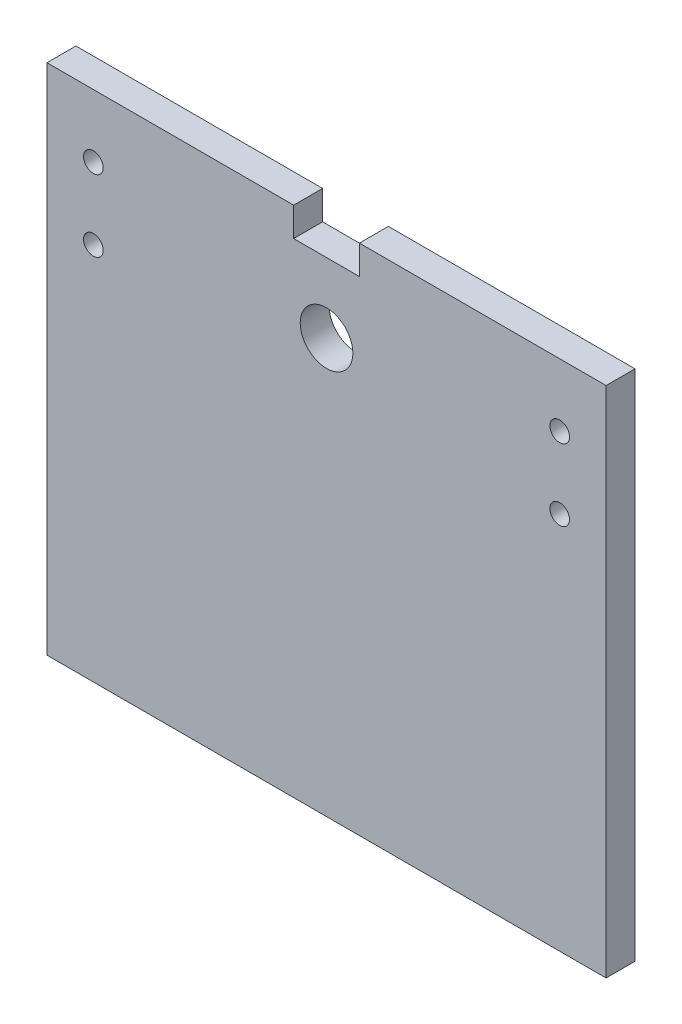
from build123d import *

# Parameters (mm, degrees)
BOSS_EXTRUDE1_DEPTH   = 2.794
F_6_CLEARANCE_HOLE1_D = 3.7973
CUT_EXTRUDE1_REACH    = 75.469
SKETCH5_R             = 5.08


with BuildPart() as part:
    # Sketch1 → Boss-Extrude1 (new, symmetric)
    with BuildSketch(Plane.XY):
        Polygon((-6.35, 49.53), (-6.35, 43.942), (6.35, 43.942), (6.35, 49.53), (53.975, 49.53), (53.975, -49.53), (-53.975, -49.53), (-53.975, 49.53), align=None)
    extrude(amount=BOSS_EXTRUDE1_DEPTH, both=True)

    # #6 Clearance Hole1 (through all)
    with Locations(Plane(origin=(0, 0, -2.794), x_dir=(-1, 0, 0), z_dir=(0, 0, -1))):
        with Locations((-45.014797213, 37.394797213), (-45.014797213, 23.565202787), (45.014797213, 37.394797213), (45.014797213, 23.565202787)):
            Hole(F_6_CLEARANCE_HOLE1_D / 2)

    # Sketch5 → Cut-Extrude1 (cut, up to next)
    with BuildSketch(Plane(origin=(0, 0, -2.794), x_dir=(-1, 0, 0), z_dir=(0, 0, -1)), mode=Mode.PRIVATE) as cut_extrude1_sk1:
        with Locations((0, 30.48)):
            Circle(SKETCH5_R)
    cut_extrude1_tool1 = extrude(cut_extrude1_sk1.sketch, amount=-CUT_EXTRUDE1_REACH, mode=Mode.PRIVATE) & part.part
    add(cut_extrude1_tool1.solids().sort_by_distance((0, 30.48, -2.794))[0], mode=Mode.SUBTRACT)


solid = part.part
